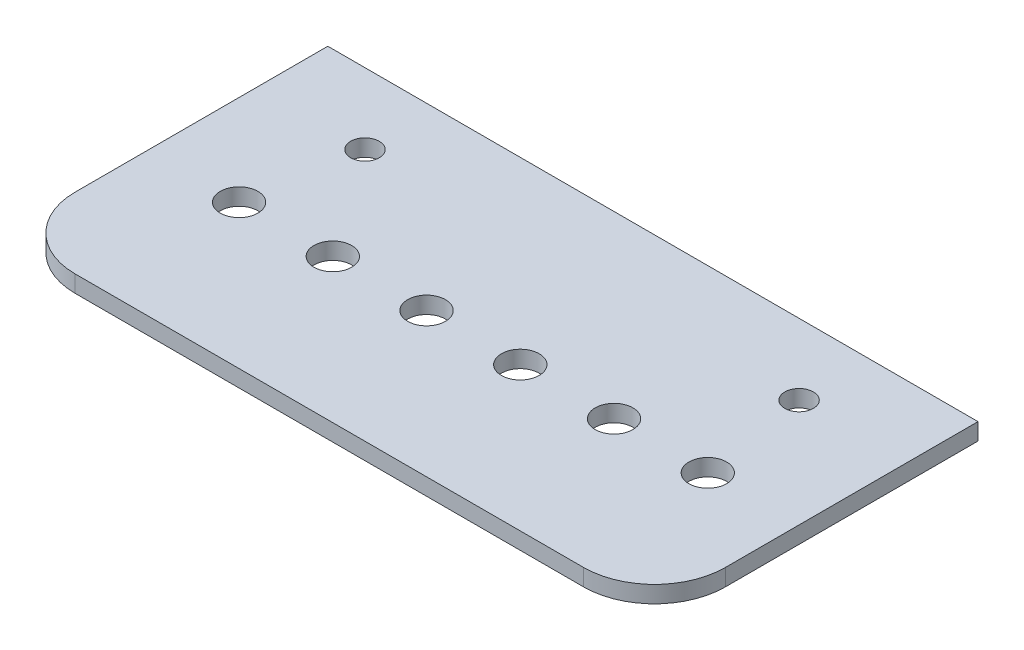
from build123d import *

# Parameters (mm, degrees)
BOSS_EXTRUDE1_DEPTH = 2.95
SKETCH5_R           = 3.3
HOLE1_DEPTH         = 81.293387804
SKETCH7_R           = 2.5
CUT_EXTRUDE2_DEPTH  = 81.293387804


with BuildPart() as part:
    # Sketch1 → Boss-Extrude1 (new body)
    with BuildSketch(Plane(origin=(0, 0, 0), x_dir=(1, 0, 0), z_dir=(0, 1, 0))):
        with BuildLine():
            Line((-44.475, 0), (44.475, 0))
            ThreePointArc((44.475, 0), (53.243124087, 3.631875913), (56.875, 12.4))
            Line((56.875, 12.4), (56.875, 56.6))
            Line((56.875, 56.6), (-56.875, 56.6))
            Line((-56.875, 56.6), (-56.875, 12.4))
            ThreePointArc((-56.875, 12.4), (-53.243124087, 3.631875913), (-44.475, 0))
        make_face()
    extrude(amount=BOSS_EXTRUDE1_DEPTH)

    # Sketch5 → Hole1 (cut, through all)
    with BuildSketch(Plane(origin=(0, 2.95, 0), x_dir=(1, 0, 0), z_dir=(0, 1, 0))):
        with Locations(Location((-41, 25.2, 0), (0, 0, 270))):
            Circle(SKETCH5_R)
        with Locations(Location((-24.6, 25.2, 0), (0, 0, 270))):
            Circle(SKETCH5_R)
        with Locations(Location((-8.2, 25.2, 0), (0, 0, 270))):
            Circle(SKETCH5_R)
        with Locations(Location((8.2, 25.2, 0), (0, 0, 270))):
            Circle(SKETCH5_R)
        with Locations(Location((24.6, 25.2, 0), (0, 0, 270))):
            Circle(SKETCH5_R)
        with Locations(Location((41, 25.2, 0), (0, 0, 270))):
            Circle(SKETCH5_R)
    extrude(amount=-HOLE1_DEPTH, mode=Mode.SUBTRACT)

    # Sketch7 → Cut-Extrude2 (cut, through all)
    with BuildSketch(Plane(origin=(0, 2.95, 0), x_dir=(1, 0, 0), z_dir=(0, 1, 0))):
        with Locations(Location((-37.975, 44.2, 0), (0, 0, 270))):
            Circle(SKETCH7_R)
    cut_extrude2 = extrude(amount=-CUT_EXTRUDE2_DEPTH, mode=Mode.SUBTRACT)

    # Mirror1: Cut-Extrude2 across plane
    add(cut_extrude2.mirror(Plane(origin=(0, 0, 0), x_dir=(0, 0, 1), z_dir=(1, 0, 0))), mode=Mode.SUBTRACT)


solid = part.part
